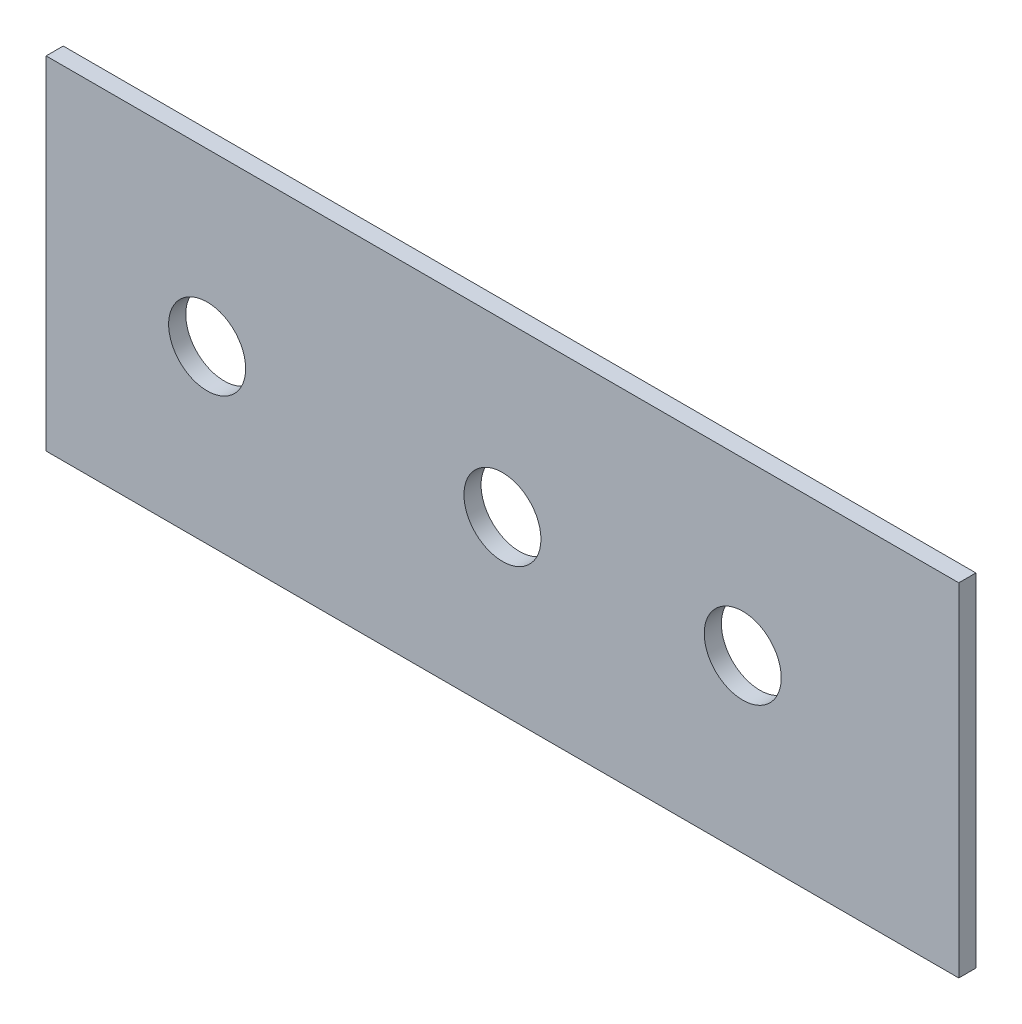
from build123d import *

# Parameters (mm, degrees)
ESQUISSE1_W               = 320
ESQUISSE1_H               = 120
BOSS_EXTRU_1_DEPTH        = 6
M25_CLEARANCE_HOLE1_D     = 27
M25_CLEARANCE_HOLE1_DEPTH = 6
M25_CLEARANCE_HOLE1_TIP   = 8.111618357


with BuildPart() as part:
    # Esquisse1 → Boss.-Extru.1 (new body)
    with BuildSketch(Plane.XY):
        Rectangle(ESQUISSE1_W, ESQUISSE1_H)
    extrude(amount=BOSS_EXTRU_1_DEPTH)

    # M25 Clearance Hole1
    with Locations(Plane.XY.offset(6)):
        with Locations((-103.53808412, 0), (0, 0), (84.253962724, 0)):
            Hole(M25_CLEARANCE_HOLE1_D / 2, depth=M25_CLEARANCE_HOLE1_DEPTH)
            with Locations((0, 0, -(M25_CLEARANCE_HOLE1_DEPTH + M25_CLEARANCE_HOLE1_TIP / 2))):  # 118° drill point
                Cone(0, M25_CLEARANCE_HOLE1_D / 2, M25_CLEARANCE_HOLE1_TIP, mode=Mode.SUBTRACT)


solid = part.part
